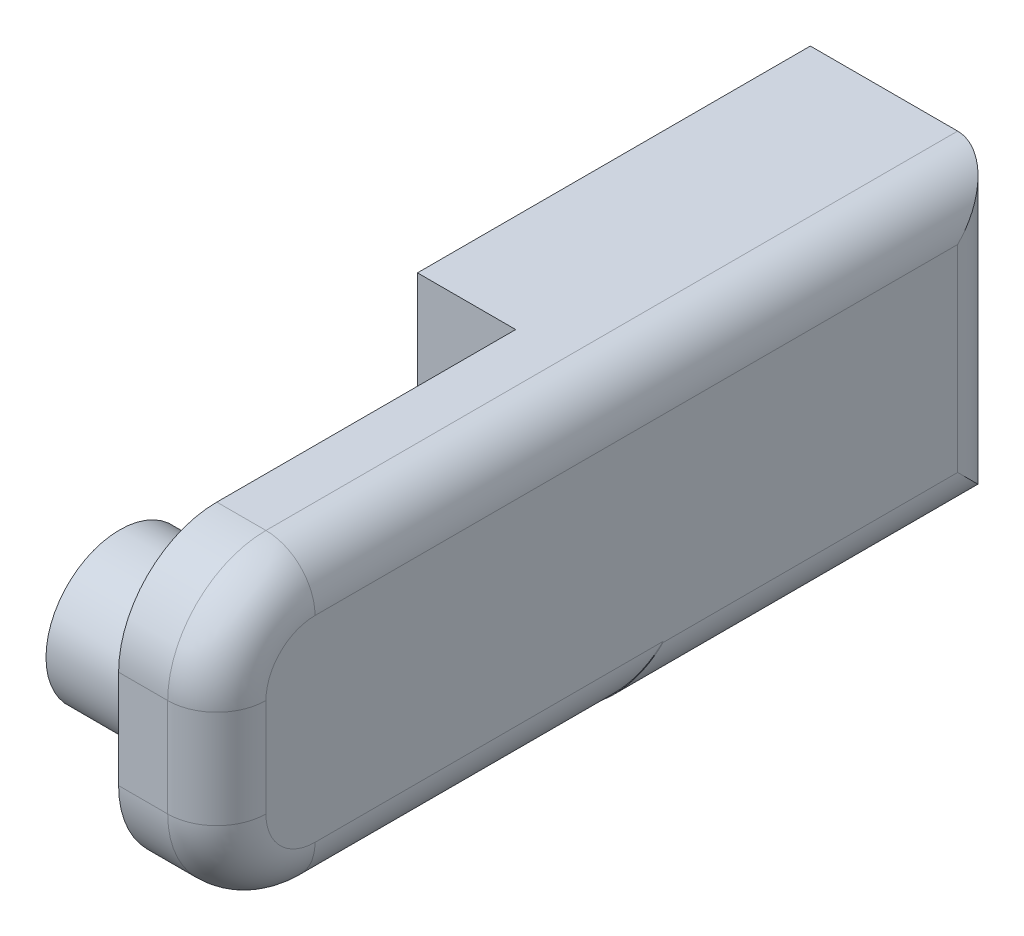
from build123d import *

# Parameters (mm, degrees)
SKETCH1_W           = 40.43076923
SKETCH1_H           = 30
BOSS_EXTRUDE1_DEPTH = 10
SKETCH2_R           = 7.5
BOSS_EXTRUDE2_DEPTH = 20
FILLET1_R           = 10
CUT_EXTRUDE1_START  = -10
SKETCH3_R           = 7.5
CUT_EXTRUDE1_DEPTH  = 10
SKETCH4_W           = 20
SKETCH4_H           = 30.102362665
BOSS_EXTRUDE3_DEPTH = 40
FILLET2_R           = 5
SKETCH5_R           = 5
CUT_EXTRUDE2_DEPTH  = 10


with BuildPart() as part:
    # Sketch1 → Boss-Extrude1 (new body)
    with BuildSketch(Plane(origin=(0, 0, 0), x_dir=(0, 0, -1), z_dir=(1, 0, 0))):
        Rectangle(SKETCH1_W, SKETCH1_H)
    extrude(amount=BOSS_EXTRUDE1_DEPTH)

    # Sketch2 → Boss-Extrude2 (add)
    with BuildSketch(Plane.ZY):
        with Locations(Location((10.107692308, 0, 0), (0, 0, 180))):
            Circle(SKETCH2_R)
    extrude(amount=BOSS_EXTRUDE2_DEPTH)

    # Fillet1
    fillet1_edges = [part.edges().sort_by_distance(p)[0] for p in [
        (5, -15, 20.215384615),
        (5, 15, 20.215384615),
    ]]
    fillet(fillet1_edges, radius=FILLET1_R)

    # Sketch3 → Cut-Extrude1 (cut)
    with BuildSketch(Plane.ZY.offset(20).offset(CUT_EXTRUDE1_START)):
        with Locations(Location((10.107692308, 0, 0), (0, 0, 180))):
            Circle(SKETCH3_R)
    extrude(amount=CUT_EXTRUDE1_DEPTH, mode=Mode.SUBTRACT)

    # Sketch4 → Boss-Extrude3 (add)
    with BuildSketch(Plane(origin=(0, 0, -20.215384615), x_dir=(-1, 0, 0), z_dir=(0, 0, -1))):
        with Locations((0, -0.051181332)):
            Rectangle(SKETCH4_W, SKETCH4_H)
    extrude(amount=BOSS_EXTRUDE3_DEPTH)

    # Fillet2
    fillet2_edges = [part.edges().sort_by_distance(p)[0] for p in [
        (10, -15, -5),
        (10, 0, 20.215384615),
        (10, 12.071067812, 17.286452427),
        (10, -12.071067812, 17.286452427),
        (10, -15.051181332, -20.215384615),
        (10, -15.102362665, -40.215384615),
        (10, -0.051181332, -60.215384615),
        (10, 15, -25),
    ]]
    fillet(fillet2_edges, radius=FILLET2_R)

    # Sketch5 → Cut-Extrude2 (cut)
    with BuildSketch(Plane(origin=(0, 0, -60.215384615), x_dir=(-1, 0, 0), z_dir=(0, 0, -1))):
        with Locations((2.5, -0.051181332)):
            Circle(SKETCH5_R)
    extrude(amount=-CUT_EXTRUDE2_DEPTH, mode=Mode.SUBTRACT)


solid = part.part
